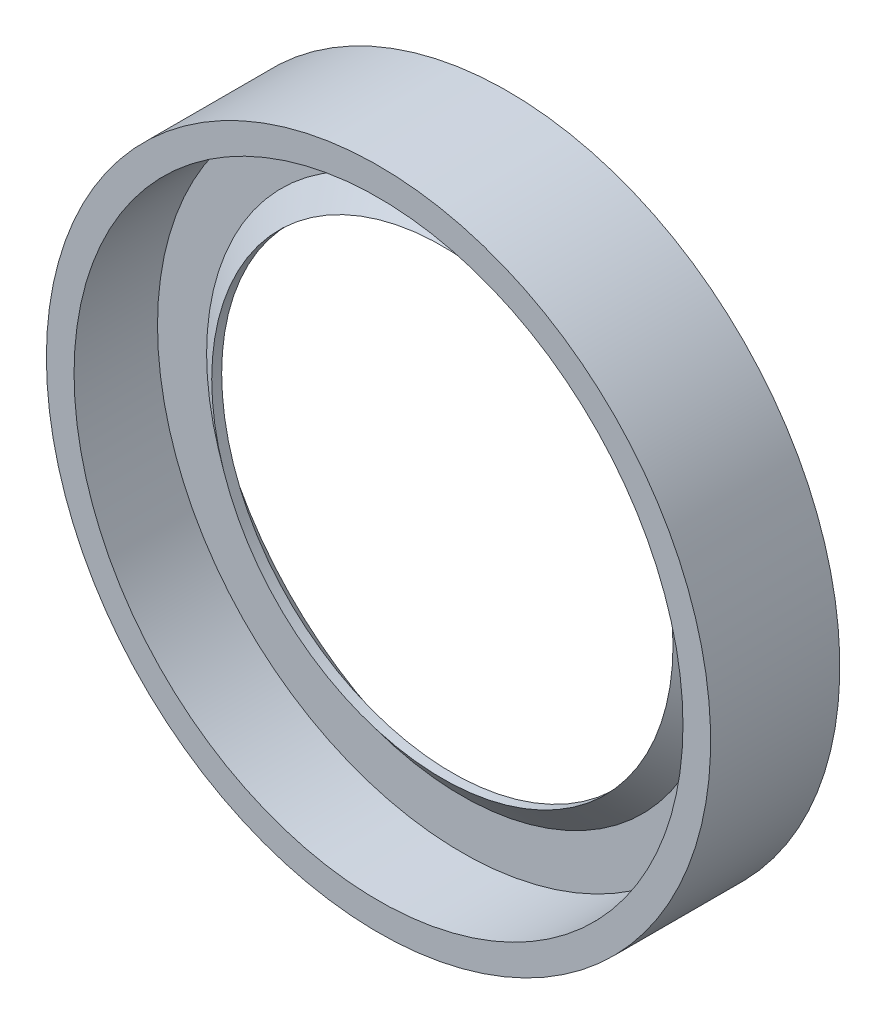
from build123d import *


with BuildPart() as part:
    # Sketch1 → Revolve1 (revolve)
    with BuildSketch(Plane(origin=(0, 0, 0), x_dir=(0, 0, -1), z_dir=(1, 0, 0)), mode=Mode.PRIVATE) as revolve1_sk:
        Polygon((0, 16.5), (0, 18), (7, 18), (7, 16.5), (4, 12.5), (3.460207762, 12.5), (4.522766352, 13.839763521), (4.522766352, 16.5), align=None)
    revolve(revolve1_sk.sketch.rotate(Axis((0, 0, -48.359584539), (0, 0, 1)), 90), axis=Axis((0, 0, -48.359584539), (0, 0, 1)))


solid = part.part
